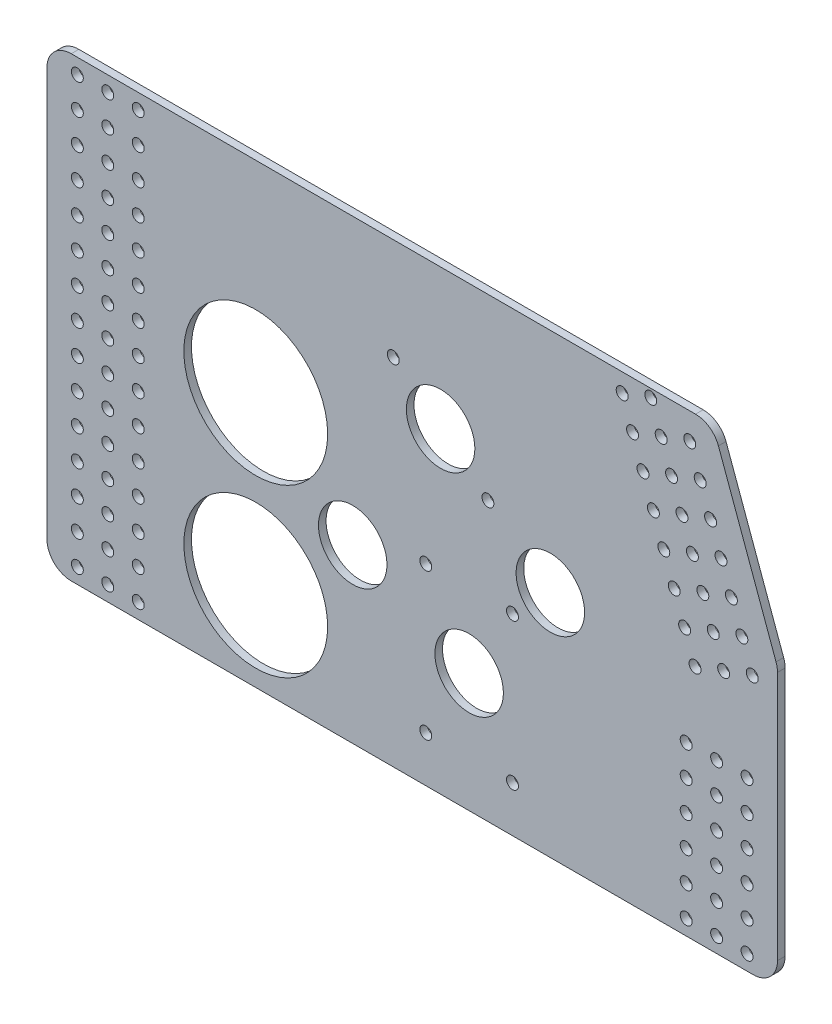
from build123d import *

# Parameters (mm, degrees)
SKETCH1_R           = 2.4892
SKETCH1_R_2         = 14.2875
SKETCH1_R_3         = 29.9974
BOSS_EXTRUDE1_DEPTH = 3.175
BOSS_EXTRUDE2_START = -3.175
SKETCH2_R           = 2.4892
BOSS_EXTRUDE2_DEPTH = 3.175
FILLET1_R           = 10.16


with BuildPart() as part:
    # Sketch1 → Boss-Extrude1 (new body)
    with BuildSketch(Plane.XY):
        Polygon((-152.4, 0), (152.4, 0), (152.4, 116.084254136), (125.314883545, 190.5), (-152.4, 190.5), align=None)
        with Locations((-139.7, 184.15)):
            Circle(SKETCH1_R, mode=Mode.SUBTRACT)
        with Locations((-127, 184.15)):
            Circle(SKETCH1_R, mode=Mode.SUBTRACT)
        with Locations((-114.3, 184.15)):
            Circle(SKETCH1_R, mode=Mode.SUBTRACT)
        with Locations((-127, 171.45)):
            Circle(SKETCH1_R, mode=Mode.SUBTRACT)
        with Locations((-114.3, 171.45)):
            Circle(SKETCH1_R, mode=Mode.SUBTRACT)
        with Locations((-127, 158.75)):
            Circle(SKETCH1_R, mode=Mode.SUBTRACT)
        with Locations((-114.3, 158.75)):
            Circle(SKETCH1_R, mode=Mode.SUBTRACT)
        with Locations((-127, 146.05)):
            Circle(SKETCH1_R, mode=Mode.SUBTRACT)
        with Locations((-114.3, 146.05)):
            Circle(SKETCH1_R, mode=Mode.SUBTRACT)
        with Locations((-127, 133.35)):
            Circle(SKETCH1_R, mode=Mode.SUBTRACT)
        with Locations((-114.3, 133.35)):
            Circle(SKETCH1_R, mode=Mode.SUBTRACT)
        with Locations((-127, 120.65)):
            Circle(SKETCH1_R, mode=Mode.SUBTRACT)
        with Locations((-114.3, 120.65)):
            Circle(SKETCH1_R, mode=Mode.SUBTRACT)
        with Locations((-127, 107.95)):
            Circle(SKETCH1_R, mode=Mode.SUBTRACT)
        with Locations((-114.3, 107.95)):
            Circle(SKETCH1_R, mode=Mode.SUBTRACT)
        with Locations((-127, 95.25)):
            Circle(SKETCH1_R, mode=Mode.SUBTRACT)
        with Locations((-114.3, 95.25)):
            Circle(SKETCH1_R, mode=Mode.SUBTRACT)
        with Locations((-127, 82.55)):
            Circle(SKETCH1_R, mode=Mode.SUBTRACT)
        with Locations((-114.3, 82.55)):
            Circle(SKETCH1_R, mode=Mode.SUBTRACT)
        with Locations((-127, 69.85)):
            Circle(SKETCH1_R, mode=Mode.SUBTRACT)
        with Locations((-114.3, 69.85)):
            Circle(SKETCH1_R, mode=Mode.SUBTRACT)
        with Locations((-127, 57.15)):
            Circle(SKETCH1_R, mode=Mode.SUBTRACT)
        with Locations((-114.3, 57.15)):
            Circle(SKETCH1_R, mode=Mode.SUBTRACT)
        with Locations((-127, 44.45)):
            Circle(SKETCH1_R, mode=Mode.SUBTRACT)
        with Locations((-114.3, 44.45)):
            Circle(SKETCH1_R, mode=Mode.SUBTRACT)
        with Locations((-127, 31.75)):
            Circle(SKETCH1_R, mode=Mode.SUBTRACT)
        with Locations((-114.3, 31.75)):
            Circle(SKETCH1_R, mode=Mode.SUBTRACT)
        with Locations((-127, 19.05)):
            Circle(SKETCH1_R, mode=Mode.SUBTRACT)
        with Locations((-114.3, 19.05)):
            Circle(SKETCH1_R, mode=Mode.SUBTRACT)
        with Locations((-127, 6.35)):
            Circle(SKETCH1_R, mode=Mode.SUBTRACT)
        with Locations((-114.3, 6.35)):
            Circle(SKETCH1_R, mode=Mode.SUBTRACT)
        with Locations((-139.7, 171.45)):
            Circle(SKETCH1_R, mode=Mode.SUBTRACT)
        with Locations((-139.7, 158.75)):
            Circle(SKETCH1_R, mode=Mode.SUBTRACT)
        with Locations((-139.7, 146.05)):
            Circle(SKETCH1_R, mode=Mode.SUBTRACT)
        with Locations((-139.7, 133.35)):
            Circle(SKETCH1_R, mode=Mode.SUBTRACT)
        with Locations((-139.7, 120.65)):
            Circle(SKETCH1_R, mode=Mode.SUBTRACT)
        with Locations((-139.7, 107.95)):
            Circle(SKETCH1_R, mode=Mode.SUBTRACT)
        with Locations((-139.7, 95.25)):
            Circle(SKETCH1_R, mode=Mode.SUBTRACT)
        with Locations((-139.7, 82.55)):
            Circle(SKETCH1_R, mode=Mode.SUBTRACT)
        with Locations((-139.7, 69.85)):
            Circle(SKETCH1_R, mode=Mode.SUBTRACT)
        with Locations((-139.7, 57.15)):
            Circle(SKETCH1_R, mode=Mode.SUBTRACT)
        with Locations((-139.7, 44.45)):
            Circle(SKETCH1_R, mode=Mode.SUBTRACT)
        with Locations((-139.7, 31.75)):
            Circle(SKETCH1_R, mode=Mode.SUBTRACT)
        with Locations((-139.7, 19.05)):
            Circle(SKETCH1_R, mode=Mode.SUBTRACT)
        with Locations((-139.7, 6.35)):
            Circle(SKETCH1_R, mode=Mode.SUBTRACT)
        with Locations((87.590706137, 182.74937795)):
            Circle(SKETCH1_R, mode=Mode.SUBTRACT)
        with Locations((99.524802421, 187.09303377)):
            Circle(SKETCH1_R, mode=Mode.SUBTRACT)
        with Locations((115.802554525, 179.502593307)):
            Circle(SKETCH1_R, mode=Mode.SUBTRACT)
        with Locations((91.934361957, 170.815281666)):
            Circle(SKETCH1_R, mode=Mode.SUBTRACT)
        with Locations((103.868458241, 175.158937486)):
            Circle(SKETCH1_R, mode=Mode.SUBTRACT)
        with Locations((120.146210345, 167.568497023)):
            Circle(SKETCH1_R, mode=Mode.SUBTRACT)
        with Locations((96.278017777, 158.881185382)):
            Circle(SKETCH1_R, mode=Mode.SUBTRACT)
        with Locations((108.212114061, 163.224841202)):
            Circle(SKETCH1_R, mode=Mode.SUBTRACT)
        with Locations((124.489866165, 155.634400739)):
            Circle(SKETCH1_R, mode=Mode.SUBTRACT)
        with Locations((100.621673597, 146.947089098)):
            Circle(SKETCH1_R, mode=Mode.SUBTRACT)
        with Locations((112.555769881, 151.290744918)):
            Circle(SKETCH1_R, mode=Mode.SUBTRACT)
        with Locations((128.833521986, 143.700304455)):
            Circle(SKETCH1_R, mode=Mode.SUBTRACT)
        with Locations((104.965329418, 135.012992814)):
            Circle(SKETCH1_R, mode=Mode.SUBTRACT)
        with Locations((116.899425702, 139.356648634)):
            Circle(SKETCH1_R, mode=Mode.SUBTRACT)
        with Locations((133.177177806, 131.766208171)):
            Circle(SKETCH1_R, mode=Mode.SUBTRACT)
        with Locations((109.308985238, 123.07889653)):
            Circle(SKETCH1_R, mode=Mode.SUBTRACT)
        with Locations((121.243081522, 127.42255235)):
            Circle(SKETCH1_R, mode=Mode.SUBTRACT)
        with Locations((137.520833626, 119.832111887)):
            Circle(SKETCH1_R, mode=Mode.SUBTRACT)
        with Locations((113.652641058, 111.144800246)):
            Circle(SKETCH1_R, mode=Mode.SUBTRACT)
        with Locations((125.586737342, 115.488456066)):
            Circle(SKETCH1_R, mode=Mode.SUBTRACT)
        with Locations((141.864489446, 107.898015603)):
            Circle(SKETCH1_R, mode=Mode.SUBTRACT)
        with Locations((117.996296878, 99.210703962)):
            Circle(SKETCH1_R, mode=Mode.SUBTRACT)
        with Locations((129.930393162, 103.554359782)):
            Circle(SKETCH1_R, mode=Mode.SUBTRACT)
        with Locations((146.208145266, 95.963919319)):
            Circle(SKETCH1_R, mode=Mode.SUBTRACT)
        with Locations((114.3, 69.85)):
            Circle(SKETCH1_R, mode=Mode.SUBTRACT)
        with Locations((127, 69.85)):
            Circle(SKETCH1_R, mode=Mode.SUBTRACT)
        with Locations((139.7, 69.85)):
            Circle(SKETCH1_R, mode=Mode.SUBTRACT)
        with Locations((114.3, 57.15)):
            Circle(SKETCH1_R, mode=Mode.SUBTRACT)
        with Locations((127, 57.15)):
            Circle(SKETCH1_R, mode=Mode.SUBTRACT)
        with Locations((139.7, 57.15)):
            Circle(SKETCH1_R, mode=Mode.SUBTRACT)
        with Locations((114.3, 44.45)):
            Circle(SKETCH1_R, mode=Mode.SUBTRACT)
        with Locations((127, 44.45)):
            Circle(SKETCH1_R, mode=Mode.SUBTRACT)
        with Locations((139.7, 44.45)):
            Circle(SKETCH1_R, mode=Mode.SUBTRACT)
        with Locations((114.3, 31.75)):
            Circle(SKETCH1_R, mode=Mode.SUBTRACT)
        with Locations((127, 31.75)):
            Circle(SKETCH1_R, mode=Mode.SUBTRACT)
        with Locations((139.7, 31.75)):
            Circle(SKETCH1_R, mode=Mode.SUBTRACT)
        with Locations((114.3, 19.05)):
            Circle(SKETCH1_R, mode=Mode.SUBTRACT)
        with Locations((127, 19.05)):
            Circle(SKETCH1_R, mode=Mode.SUBTRACT)
        with Locations((139.7, 19.05)):
            Circle(SKETCH1_R, mode=Mode.SUBTRACT)
        with Locations((114.3, 6.35)):
            Circle(SKETCH1_R, mode=Mode.SUBTRACT)
        with Locations((127, 6.35)):
            Circle(SKETCH1_R, mode=Mode.SUBTRACT)
        with Locations((139.7, 6.35)):
            Circle(SKETCH1_R, mode=Mode.SUBTRACT)
        with Locations((11.850775283, 132.016841695)):
            Circle(SKETCH1_R_2, mode=Mode.SUBTRACT)
        with Locations((-24.819733341, 71.744857423)):
            Circle(SKETCH1_R_2, mode=Mode.SUBTRACT)
        with Locations((57.635078008, 95.712451111)):
            Circle(SKETCH1_R_2, mode=Mode.SUBTRACT)
        with Locations((23.754601626, 49.678686248)):
            Circle(SKETCH1_R_2, mode=Mode.SUBTRACT)
        with Locations((-65.270180641, 36.953448556)):
            Circle(SKETCH1_R_3, mode=Mode.SUBTRACT)
        with Locations((-65.270180641, 106.549448556)):
            Circle(SKETCH1_R_3, mode=Mode.SUBTRACT)
        with Locations((-7.893480799, 147.995713738)):
            Circle(SKETCH1_R, mode=Mode.SUBTRACT)
        with Locations((31.595031365, 116.037969652)):
            Circle(SKETCH1_R, mode=Mode.SUBTRACT)
        with Locations((5.669801626, 80.209486248)):
            Circle(SKETCH1_R, mode=Mode.SUBTRACT)
        with Locations((41.839401626, 80.209486248)):
            Circle(SKETCH1_R, mode=Mode.SUBTRACT)
        with Locations((41.839401626, 19.147886248)):
            Circle(SKETCH1_R, mode=Mode.SUBTRACT)
        with Locations((5.669801626, 19.147886248)):
            Circle(SKETCH1_R, mode=Mode.SUBTRACT)
    extrude(amount=BOSS_EXTRUDE1_DEPTH)

    # Sketch2 → Boss-Extrude2 (add)
    with BuildSketch(Plane.XY.offset(3.175).offset(BOSS_EXTRUDE2_START)):
        with Locations((146.208145266, 95.963919319)):
            Circle(SKETCH2_R)
    extrude(amount=BOSS_EXTRUDE2_DEPTH)

    # Fillet1
    fillet1_edges = [part.edges().sort_by_distance(p)[0] for p in [
        (-152.4, 190.5, 1.5875),
        (125.314883545, 190.5, 1.5875),
        (152.4, 116.084254136, 1.5875),
        (152.4, 0, 1.5875),
        (-152.4, 0, 1.5875),
    ]]
    fillet(fillet1_edges, radius=FILLET1_R)


solid = part.part
